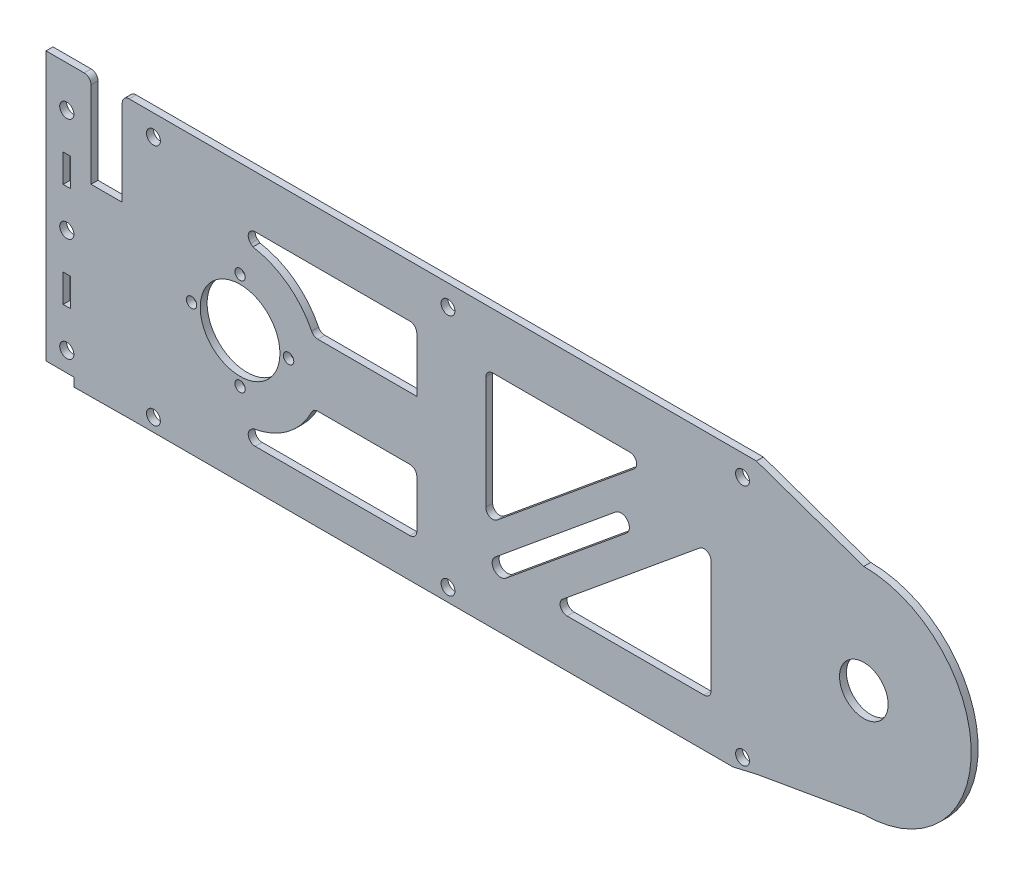
from build123d import *

# Parameters (mm, degrees)
SKETCH_1_R          = 2.05
SKETCH_1_R_2        = 11.5
SKETCH_1_R_3        = 1.5
SKETCH_1_R_4        = 7.02
SKETCH_1_W          = 2.1
SKETCH_1_H          = 8.1
EXTRUDE_1_DEPTH     = 2
SKETCH_2_R          = 2
CUT_EXTRUDE_1_DEPTH = 4
FILLET_1_R          = 2


with BuildPart() as part:
    # 草图1 → 凸台-拉伸1 (new body)
    with BuildSketch(Plane.XY):
        with BuildLine():
            Line((-4.357142857, -0.045714286), (-4.357142857, 41.804285714))
            Line((-4.357142857, 41.804285714), (8.642857143, 41.804285714))
            Line((8.642857143, 41.804285714), (8.642857143, 14.954285714))
            Line((8.642857143, 14.954285714), (17.642857143, 14.954285714))
            Line((17.642857143, 14.954285714), (17.642857143, 41.804285714))
            Line((17.642857143, 41.804285714), (200.642857143, 41.804285714))
            Line((200.642857143, 41.804285714), (231.642857143, 30.954285714))
            ThreePointArc((231.642857143, 30.954285714), (262.642857143, -0.045714286), (231.642857143, -31.045714286))
            Line((231.642857143, -31.045714286), (200.656073527, -36.45591431))
            Line((200.656073527, -36.45591431), (193.846868021, -38.045714286))
            Line((193.846868021, -38.045714286), (22.465844759, -38.045714286))
            Line((22.465844759, -38.045714286), (3.792857143, -38.195714286))
            Line((3.792857143, -38.195714286), (3.792857143, -35.702553436))
            Line((3.792857143, -35.702553436), (-4.357142857, -35.702553436))
            Line((-4.357142857, -35.702553436), (-4.357142857, -0.045714286))
        make_face()
        with Locations((1.642857143, 29.954285714)):
            Circle(SKETCH_1_R, mode=Mode.SUBTRACT)
        with Locations((1.642857143, -0.045714286)):
            Circle(SKETCH_1_R, mode=Mode.SUBTRACT)
        with Locations((1.642857143, -30.045714286)):
            Circle(SKETCH_1_R, mode=Mode.SUBTRACT)
        with Locations((51.642857143, -0.045714286)):
            Circle(SKETCH_1_R_2, mode=Mode.SUBTRACT)
        with Locations((51.642857143, -14.045714286)):
            Circle(SKETCH_1_R_3, mode=Mode.SUBTRACT)
        with Locations((37.642857143, -0.045714286)):
            Circle(SKETCH_1_R_3, mode=Mode.SUBTRACT)
        with Locations((51.642857143, 13.954285714)):
            Circle(SKETCH_1_R_3, mode=Mode.SUBTRACT)
        with Locations((65.642857143, -0.045714286)):
            Circle(SKETCH_1_R_3, mode=Mode.SUBTRACT)
        with Locations((231.642857143, -0.045714286)):
            Circle(SKETCH_1_R_4, mode=Mode.SUBTRACT)
        with Locations((1.642857143, 14.954285714)):
            Rectangle(SKETCH_1_W, SKETCH_1_H, mode=Mode.SUBTRACT)
        with Locations((1.642857143, -15.045714286)):
            Rectangle(SKETCH_1_W, SKETCH_1_H, mode=Mode.SUBTRACT)
    extrude(amount=EXTRUDE_1_DEPTH)

    # 草图2 → 切除-拉伸1 (cut)
    with BuildSketch(Plane.XY.offset(2)):
        with Locations((26.642857143, 35.754285714)):
            Circle(SKETCH_2_R)
        with Locations((111.642857143, 35.754285714)):
            Circle(SKETCH_2_R)
        with Locations((196.642857143, 35.754285714)):
            Circle(SKETCH_2_R)
        with Locations((111.642857143, -34.245714286)):
            Circle(SKETCH_2_R)
        with Locations((196.642857143, -34.245714286)):
            Circle(SKETCH_2_R)
        with Locations((26.642857143, -34.245714286)):
            Circle(SKETCH_2_R)
        Polygon((187.542857143, -24.245714286), (140.41622539, -24.245714286), (187.542857143, 14.56445304), align=None)
        Polygon((122.542857143, 25.754285714), (169.669488896, 25.754285714), (122.542857143, -13.055881612), align=None)
        with BuildLine():
            Line((72.808867631, 8.954285714), (102.642857143, 8.954285714))
            Line((102.642857143, 8.954285714), (102.642857143, 26.754285714))
            Line((102.642857143, 26.754285714), (50.657939371, 26.754285714))
            Line((50.657939371, 26.754285714), (55.363054959, 22.651424922))
            ThreePointArc((55.363054959, 22.651424922), (65.846157695, 18.044787461), (72.808867631, 8.954285714))
        make_face()
        with BuildLine():
            Line((102.642857143, -9.045714286), (102.642857143, -26.845714286))
            Line((102.642857143, -26.845714286), (50.657939371, -26.845714286))
            Line((50.657939371, -26.845714286), (55.363054959, -22.742853493))
            ThreePointArc((55.363054959, -22.742853493), (65.846157695, -18.136216032), (72.808867631, -9.045714286))
            Line((72.808867631, -9.045714286), (102.642857143, -9.045714286))
        make_face()
        with BuildLine():
            Line((125.279005787, -19.870759717), (160.01586639, 8.736066661))
            ThreePointArc((160.01586639, 8.736066661), (163.433418031, 8.405335857), (163.102687227, 4.987784217))
            Line((163.102687227, 4.987784217), (128.365826624, -23.619042162))
            ThreePointArc((128.365826624, -23.619042162), (124.948274984, -23.288311358), (125.279005787, -19.870759717))
        make_face()
    extrude(amount=-CUT_EXTRUDE_1_DEPTH, mode=Mode.SUBTRACT)

    # 圆角1
    fillet_1_edges = [part.edges().sort_by_distance(p)[0] for p in [
        (72.808867631, 8.954285714, 1),
        (50.657939371, 26.754285714, 1),
        (102.642857143, 26.754285714, 1),
        (122.542857143, -13.055881612, 1),
        (122.542857143, 25.754285714, 1),
        (169.669488896, 25.754285714, 1),
        (187.542857143, 14.56445304, 1),
        (187.542857143, -24.245714286, 1),
        (140.41622539, -24.245714286, 1),
        (102.642857143, -26.845714286, 1),
        (50.657939371, -26.845714286, 1),
        (72.808867631, -9.045714286, 1),
        (102.642857143, -9.045714286, 1),
        (8.642857143, 41.804285714, 1),
        (17.642857143, 41.804285714, 1),
    ]]
    fillet(fillet_1_edges, radius=FILLET_1_R)


solid = part.part
